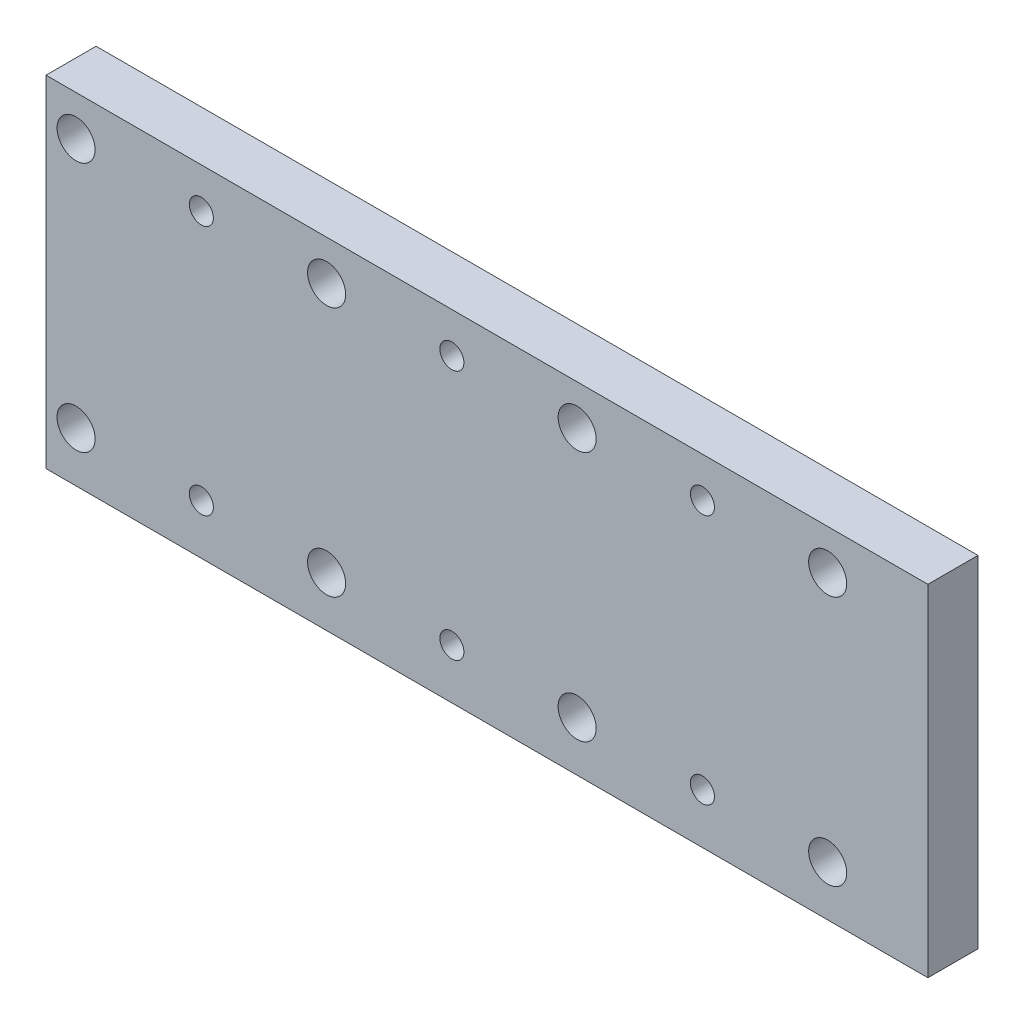
from build123d import *

# Parameters (mm, degrees)
SKETCH1_W           = 440
SKETCH1_H           = 170
BOSS_EXTRUDE1_DEPTH = 25
SKETCH2_R           = 9.5
CUT_EXTRUDE1_DEPTH  = 15
SKETCH4_R           = 6
CUT_EXTRUDE3_DEPTH  = 237.326045962
SKETCH3_R           = 9.5
CUT_EXTRUDE2_DEPTH  = 15
SKETCH5_R           = 6
CUT_EXTRUDE4_DEPTH  = 237.326045962


with BuildPart() as part:
    # Sketch1 → Boss-Extrude1 (new body)
    with BuildSketch(Plane.XY):
        Rectangle(SKETCH1_W, SKETCH1_H)
    extrude(amount=BOSS_EXTRUDE1_DEPTH)

    # Sketch2 → Cut-Extrude1 (cut)
    with BuildSketch(Plane.XY.offset(25)):
        with Locations((170, 65)):
            Circle(SKETCH2_R)
        with Locations((45, 65)):
            Circle(SKETCH2_R)
        with Locations((-80, 65)):
            Circle(SKETCH2_R)
        with Locations((-205, 65)):
            Circle(SKETCH2_R)
        with Locations((45, -60)):
            Circle(SKETCH2_R)
        with Locations((-80, -60)):
            Circle(SKETCH2_R)
        with Locations((-205, -60)):
            Circle(SKETCH2_R)
        with Locations((170, -60)):
            Circle(SKETCH2_R)
    extrude(amount=-CUT_EXTRUDE1_DEPTH, mode=Mode.SUBTRACT)

    # Sketch4 → Cut-Extrude3 (cut, through all)
    with BuildSketch(Plane.XY.offset(10)):
        with Locations((170, 65)):
            Circle(SKETCH4_R)
        with Locations((45, 65)):
            Circle(SKETCH4_R)
        with Locations((-80, 65)):
            Circle(SKETCH4_R)
        with Locations((-205, 65)):
            Circle(SKETCH4_R)
        with Locations((45, -60)):
            Circle(SKETCH4_R)
        with Locations((-80, -60)):
            Circle(SKETCH4_R)
        with Locations((-205, -60)):
            Circle(SKETCH4_R)
        with Locations((170, -60)):
            Circle(SKETCH4_R)
    extrude(amount=-CUT_EXTRUDE3_DEPTH, mode=Mode.SUBTRACT)

    # Sketch3 → Cut-Extrude2 (cut)
    with BuildSketch(Plane(origin=(0, 0, 0), x_dir=(-1, 0, 0), z_dir=(0, 0, -1))):
        with Locations((-107.5, -60)):
            Circle(SKETCH3_R)
        with Locations((17.5, -60)):
            Circle(SKETCH3_R)
        with Locations((142.5, -60)):
            Circle(SKETCH3_R)
        with Locations((17.5, 65)):
            Circle(SKETCH3_R)
        with Locations((142.5, 65)):
            Circle(SKETCH3_R)
        with Locations((-107.5, 65)):
            Circle(SKETCH3_R)
    extrude(amount=-CUT_EXTRUDE2_DEPTH, mode=Mode.SUBTRACT)

    # Sketch5 → Cut-Extrude4 (cut, through all)
    with BuildSketch(Plane(origin=(0, 0, 15), x_dir=(-1, 0, 0), z_dir=(0, 0, -1))):
        with Locations((-107.5, -60)):
            Circle(SKETCH5_R)
        with Locations((17.5, -60)):
            Circle(SKETCH5_R)
        with Locations((142.5, -60)):
            Circle(SKETCH5_R)
        with Locations((17.5, 65)):
            Circle(SKETCH5_R)
        with Locations((142.5, 65)):
            Circle(SKETCH5_R)
        with Locations((-107.5, 65)):
            Circle(SKETCH5_R)
    extrude(amount=-CUT_EXTRUDE4_DEPTH, mode=Mode.SUBTRACT)


solid = part.part
